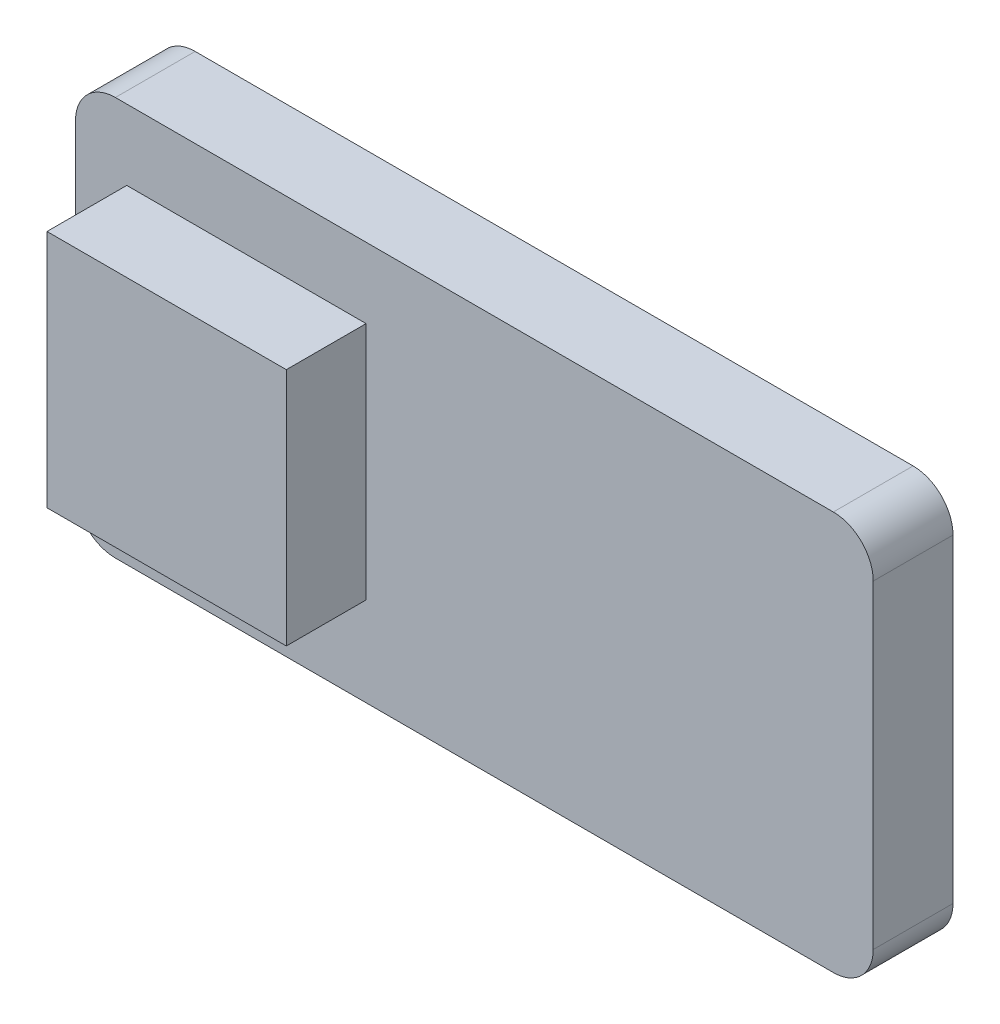
from build123d import *

# Parameters (mm, degrees)
SKETCH1_W           = 20
SKETCH1_H           = 10
BOSS_EXTRUDE1_DEPTH = 2
FILLET1_R           = 1
SKETCH2_W           = 6
SKETCH2_H           = 6
BOSS_EXTRUDE2_DEPTH = 2


with BuildPart() as part:
    # Sketch1 → Boss-Extrude1 (new body)
    with BuildSketch(Plane.XY):
        with Locations((0, -27.096458497)):
            Rectangle(SKETCH1_W, SKETCH1_H)
    extrude(amount=BOSS_EXTRUDE1_DEPTH)

    # Fillet1
    fillet1_edges = [part.edges().sort_by_distance(p)[0] for p in [
        (-10, -22.096458497, 1),
        (10, -22.096458497, 1),
        (10, -32.096458497, 1),
        (-10, -32.096458497, 1),
    ]]
    fillet(fillet1_edges, radius=FILLET1_R)

    # Sketch2 → Boss-Extrude2 (add)
    with BuildSketch(Plane.XY.offset(2)):
        with Locations((-5.714480975, -26.862957006)):
            Rectangle(SKETCH2_W, SKETCH2_H)
    extrude(amount=BOSS_EXTRUDE2_DEPTH)


solid = part.part
